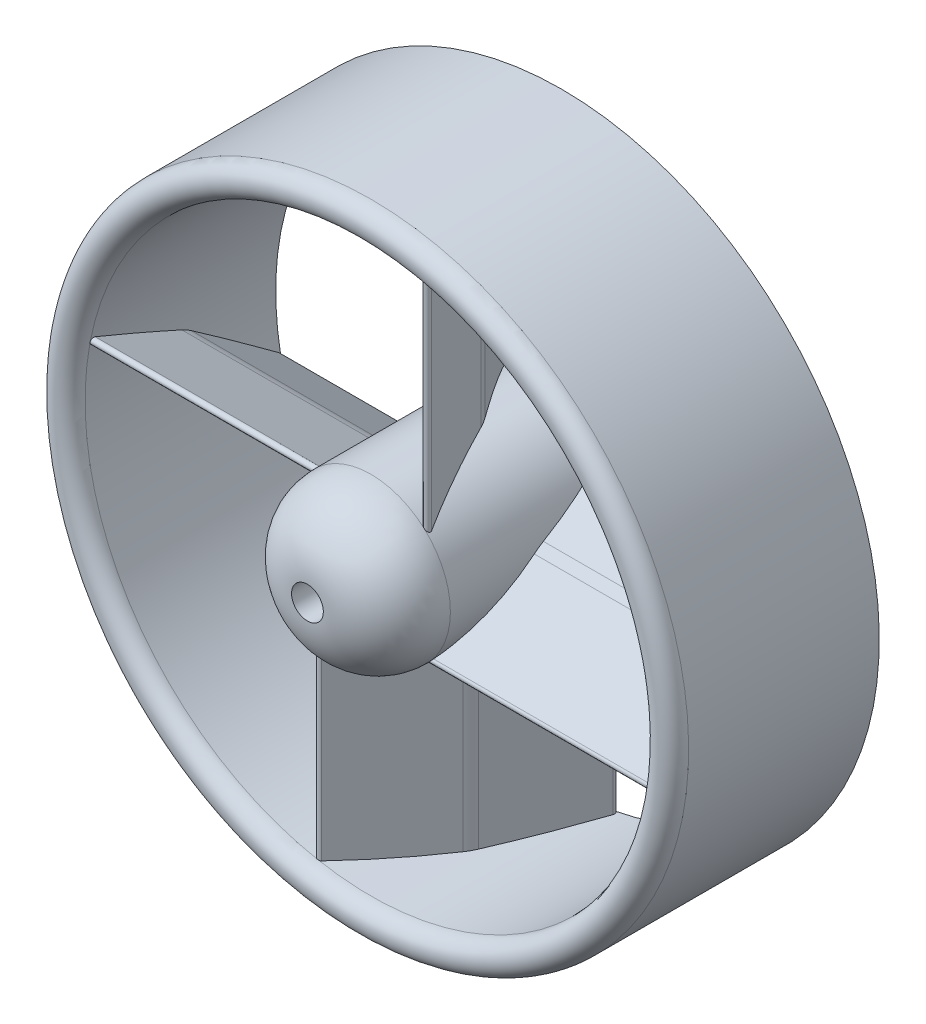
from build123d import *
from build123d.topology import SkipClean

# Parameters (mm, degrees)
EXTRUDE_2_REACH          = 87.24
EXTRUDE_2_END_RADIUS     = 45
EXTRUDE_START            = 4
PATTERN_CIRCULAR_1_COUNT = 4


with BuildPart() as part:
    # 草图3 → 旋转1 (revolve)
    with BuildSketch(Plane(origin=(0, 0, 0), x_dir=(0, 0, -1), z_dir=(1, 0, 0))):
        with BuildLine():
            Line((-30, 45), (0, 45))
            Line((0, 45), (0, 50))
            Line((0, 50), (-30, 50))
            ThreePointArc((-30, 50), (-32.5, 47.5), (-30, 45))
        make_face()
        with BuildLine():
            Line((-30, 2.5), (-40, 2.5))
            ThreePointArc((-40, 2.5), (-37.071067812, 9.571067812), (-30, 12.5))
            Line((-30, 12.5), (0, 12.5))
            Line((0, 12.5), (0, 2.5))
            Line((0, 2.5), (-30, 2.5))
        make_face()
    revolve(axis=Axis((0, 0, 0), (0, 0, 1)))

    # 凸台-拉伸2: up to this cylinder (the profile starts inside it)
    with SkipClean():  # the faces are left unmerged after this step: merging them gives an invalid solid
        extrude_2_end = Plane(origin=(0, 0, 15), z_dir=(0, 0, -1)) * Cylinder(EXTRUDE_2_END_RADIUS, 265.48, mode=Mode.PRIVATE)
        # 草图6 → 凸台-拉伸2 (add, up to the surface)
        with BuildSketch(Plane(origin=(0, 0, 0), x_dir=(0, 0, -1), z_dir=(1, 0, 0)).offset(EXTRUDE_START), mode=Mode.PRIVATE) as extrude_2_sk1:
            with BuildLine():
                Line((-29.787592685, -7.962567354), (-16.731881583, 1.217435048))
                ThreePointArc((-16.731881583, 1.217435048), (-15.980027888, 1.697458094), (-15.188388887, 2.108570971))
                Line((-15.188388887, 2.108570971), (-0.71041805, 8.825147249))
                ThreePointArc((-0.71041805, 8.825147249), (-0.066987298, 8.621578903), (-0.212407315, 7.962567354))
                Line((-0.212407315, 7.962567354), (-13.268118417, -1.217435048))
                ThreePointArc((-13.268118417, -1.217435048), (-14.019972112, -1.697458094), (-14.811611113, -2.108570971))
                Line((-14.811611113, -2.108570971), (-29.28958195, -8.825147249))
                ThreePointArc((-29.28958195, -8.825147249), (-29.933012702, -8.621578903), (-29.787592685, -7.962567354))
            make_face()
        extrude_2_tool1 = extrude(extrude_2_sk1.sketch, amount=EXTRUDE_2_REACH, mode=Mode.PRIVATE) & extrude_2_end
        extrude_2 = extrude_2_tool1.solids().sort_by_distance((4, 0, 15))[0]
        add(extrude_2)

    # 阵列(圆周)1: 凸台-拉伸2 ×4 about axis
    pattern_circular_1_axis = Axis((0, 0, 0), (0, 0, -1))
    for i in range(1, PATTERN_CIRCULAR_1_COUNT):
        add(extrude_2.rotate(pattern_circular_1_axis, i * 360 / PATTERN_CIRCULAR_1_COUNT))


solid = part.part
